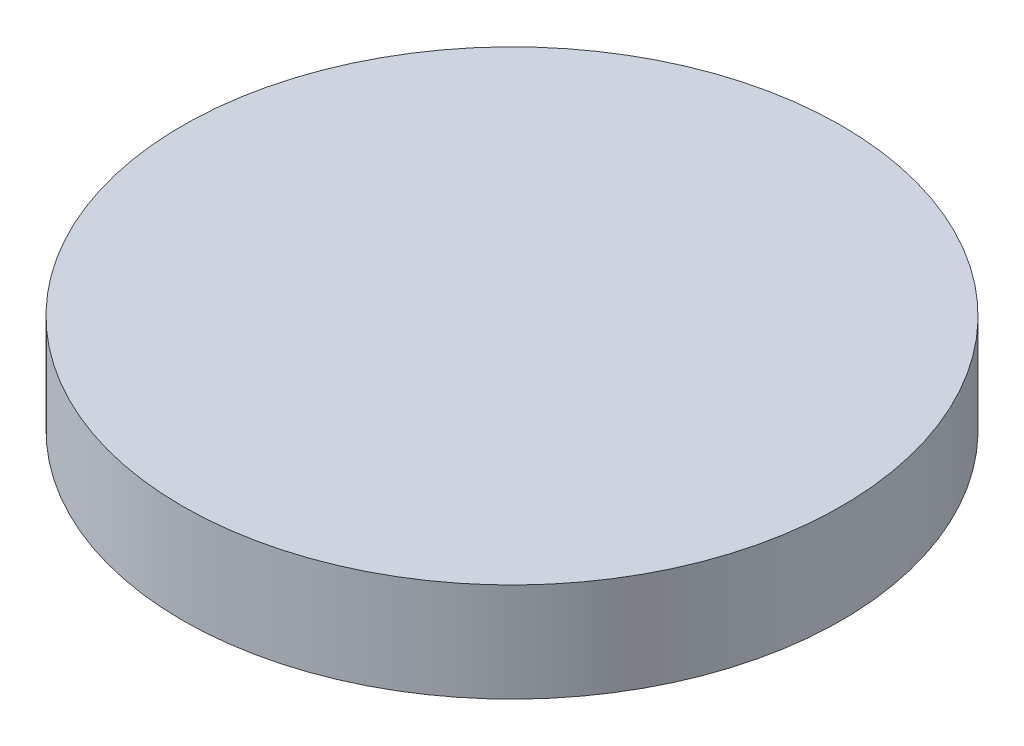
from build123d import *

# Parameters (mm, degrees)
ESQUISSE1_R        = 5
BOSS_EXTRU_1_DEPTH = 1.5


with BuildPart() as part:
    # Esquisse1 → Boss.-Extru.1 (new body)
    with BuildSketch(Plane(origin=(0, 0, 0), x_dir=(-1, 0, 0), z_dir=(0, 1, 0))):
        with Locations(Location((0, 0, 0), (0, 0, 90))):
            Circle(ESQUISSE1_R)
    extrude(amount=BOSS_EXTRU_1_DEPTH)


solid = part.part
